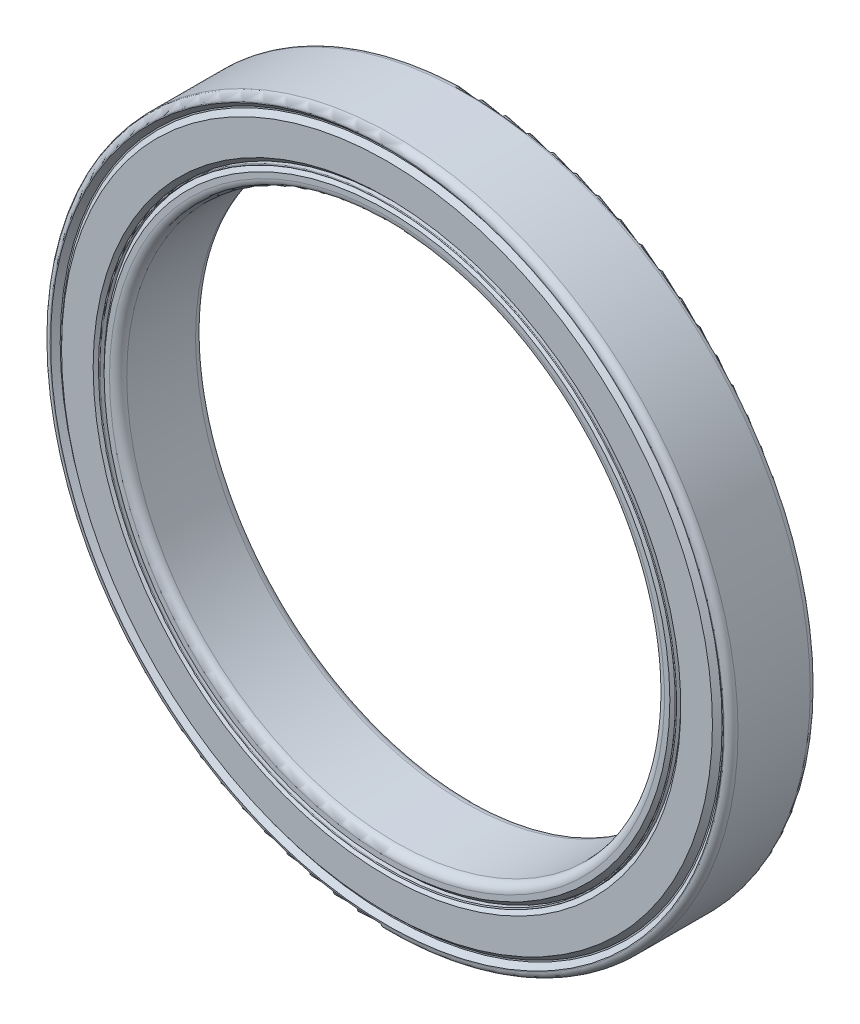
from build123d import *

# Parameters (mm, degrees)
SKETCH3_W         = 4
SKETCH3_H         = 0.583333333
SKETCH3_H_2       = 0.875
SKETCH4_R         = 1.225
CIRPATTERN1_COUNT = 23
FILLET1_R         = 0.32
FILLET2_R         = 0.4
CHAMFER1_SIZE     = 0.224
CHAMFER2_SIZE     = 0.224


with BuildPart() as part:
    # Sketch3 → Revolve1 (revolve)
    with BuildSketch(Plane(origin=(0, 0, 0), x_dir=(0, 0, -1), z_dir=(1, 0, 0)), mode=Mode.PRIVATE) as revolve1_sk:
        with Locations((0, -15.708333334)):
            Rectangle(SKETCH3_W, SKETCH3_H)
        with Locations((0, -12.9375)):
            Rectangle(SKETCH3_W, SKETCH3_H_2)
    revolve(revolve1_sk.sketch.rotate(Axis((0, 0, -2), (0, 0, 1)), 270), axis=Axis((0, 0, -2), (0, 0, 1)))

    # Sketch4 → Cut-Revolve1 (revolve, cut)
    with BuildSketch(Plane(origin=(0, 0, 0), x_dir=(0, 0, -1), z_dir=(1, 0, 0)), mode=Mode.PRIVATE) as cut_revolve1_sk:
        with Locations((0, -14.395833333)):
            Circle(SKETCH4_R)
    revolve(cut_revolve1_sk.sketch.rotate(Axis((0, 0, -2), (0, 0, 1)), 270), axis=Axis((0, 0, -2), (0, 0, 1)), mode=Mode.SUBTRACT)

    # Fillet1
    fillet1_edges = [part.edges().sort_by_distance(p)[0] for p in [
        (16, 0, -2),
        (16, 0, 2),
    ]]
    fillet(fillet1_edges, radius=FILLET1_R)

    # Fillet2
    fillet2_edges = [part.edges().sort_by_distance(p)[0] for p in [
        (12.5, 0, -2),
        (12.5, 0, 2),
    ]]
    fillet(fillet2_edges, radius=FILLET2_R)

    # Chamfer1
    chamfer1_edges = [part.edges().sort_by_distance(p)[0] for p in [
        (15.416666667, 0, 2),
        (15.416666667, 0, -2),
    ]]
    chamfer(chamfer1_edges, length=CHAMFER1_SIZE)

    # Chamfer2
    chamfer2_edges = [part.edges().sort_by_distance(p)[0] for p in [
        (13.375, 0, 2),
        (13.375, 0, -2),
    ]]
    chamfer(chamfer2_edges, length=CHAMFER2_SIZE)


with BuildPart() as body_2:
    # Sketch5 → Revolve2 (revolve)
    with BuildSketch(Plane(origin=(0, 0, 0), x_dir=(0, 0, -1), z_dir=(1, 0, 0))):
        with BuildLine():
            Line((0, -13.170833333), (0, -15.620833333))
            ThreePointArc((0, -15.620833333), (1.225, -14.395833333), (0, -13.170833333))
        make_face()
    revolve(axis=Axis((0, -13.170833333, 0), (0, -1, 0)))


with BuildPart() as cirpattern1_1:
    # CirPattern1: pattern copy
    add(body_2.part.rotate(Axis((0, 0, 0), (0, 0, 1)), 1 * 360 / CIRPATTERN1_COUNT))


with BuildPart() as cirpattern1_2:
    # CirPattern1: pattern copy
    add(body_2.part.rotate(Axis((0, 0, 0), (0, 0, 1)), 2 * 360 / CIRPATTERN1_COUNT))


with BuildPart() as cirpattern1_3:
    # CirPattern1: pattern copy
    add(body_2.part.rotate(Axis((0, 0, 0), (0, 0, 1)), 3 * 360 / CIRPATTERN1_COUNT))


with BuildPart() as cirpattern1_4:
    # CirPattern1: pattern copy
    add(body_2.part.rotate(Axis((0, 0, 0), (0, 0, 1)), 4 * 360 / CIRPATTERN1_COUNT))


with BuildPart() as cirpattern1_5:
    # CirPattern1: pattern copy
    add(body_2.part.rotate(Axis((0, 0, 0), (0, 0, 1)), 5 * 360 / CIRPATTERN1_COUNT))


with BuildPart() as cirpattern1_6:
    # CirPattern1: pattern copy
    add(body_2.part.rotate(Axis((0, 0, 0), (0, 0, 1)), 6 * 360 / CIRPATTERN1_COUNT))


with BuildPart() as cirpattern1_7:
    # CirPattern1: pattern copy
    add(body_2.part.rotate(Axis((0, 0, 0), (0, 0, 1)), 7 * 360 / CIRPATTERN1_COUNT))


with BuildPart() as cirpattern1_8:
    # CirPattern1: pattern copy
    add(body_2.part.rotate(Axis((0, 0, 0), (0, 0, 1)), 8 * 360 / CIRPATTERN1_COUNT))


with BuildPart() as cirpattern1_9:
    # CirPattern1: pattern copy
    add(body_2.part.rotate(Axis((0, 0, 0), (0, 0, 1)), 9 * 360 / CIRPATTERN1_COUNT))


with BuildPart() as cirpattern1_10:
    # CirPattern1: pattern copy
    add(body_2.part.rotate(Axis((0, 0, 0), (0, 0, 1)), 10 * 360 / CIRPATTERN1_COUNT))


with BuildPart() as cirpattern1_11:
    # CirPattern1: pattern copy
    add(body_2.part.rotate(Axis((0, 0, 0), (0, 0, 1)), 11 * 360 / CIRPATTERN1_COUNT))


with BuildPart() as cirpattern1_12:
    # CirPattern1: pattern copy
    add(body_2.part.rotate(Axis((0, 0, 0), (0, 0, 1)), 12 * 360 / CIRPATTERN1_COUNT))


with BuildPart() as cirpattern1_13:
    # CirPattern1: pattern copy
    add(body_2.part.rotate(Axis((0, 0, 0), (0, 0, 1)), 13 * 360 / CIRPATTERN1_COUNT))


with BuildPart() as cirpattern1_14:
    # CirPattern1: pattern copy
    add(body_2.part.rotate(Axis((0, 0, 0), (0, 0, 1)), 14 * 360 / CIRPATTERN1_COUNT))


with BuildPart() as cirpattern1_15:
    # CirPattern1: pattern copy
    add(body_2.part.rotate(Axis((0, 0, 0), (0, 0, 1)), 15 * 360 / CIRPATTERN1_COUNT))


with BuildPart() as cirpattern1_16:
    # CirPattern1: pattern copy
    add(body_2.part.rotate(Axis((0, 0, 0), (0, 0, 1)), 16 * 360 / CIRPATTERN1_COUNT))


with BuildPart() as cirpattern1_17:
    # CirPattern1: pattern copy
    add(body_2.part.rotate(Axis((0, 0, 0), (0, 0, 1)), 17 * 360 / CIRPATTERN1_COUNT))


with BuildPart() as cirpattern1_18:
    # CirPattern1: pattern copy
    add(body_2.part.rotate(Axis((0, 0, 0), (0, 0, 1)), 18 * 360 / CIRPATTERN1_COUNT))


with BuildPart() as cirpattern1_19:
    # CirPattern1: pattern copy
    add(body_2.part.rotate(Axis((0, 0, 0), (0, 0, 1)), 19 * 360 / CIRPATTERN1_COUNT))


with BuildPart() as cirpattern1_20:
    # CirPattern1: pattern copy
    add(body_2.part.rotate(Axis((0, 0, 0), (0, 0, 1)), 20 * 360 / CIRPATTERN1_COUNT))


with BuildPart() as cirpattern1_21:
    # CirPattern1: pattern copy
    add(body_2.part.rotate(Axis((0, 0, 0), (0, 0, 1)), 21 * 360 / CIRPATTERN1_COUNT))


with BuildPart() as cirpattern1_22:
    # CirPattern1: pattern copy
    add(body_2.part.rotate(Axis((0, 0, 0), (0, 0, 1)), 22 * 360 / CIRPATTERN1_COUNT))


with BuildPart() as body_25:
    # Sketch6 → Revolve3 (revolve)
    with BuildSketch(Plane(origin=(0, 0, 0), x_dir=(0, 0, -1), z_dir=(1, 0, 0)), mode=Mode.PRIVATE) as revolve3_sk:
        Polygon((-2, -13.66025), (-2, -15.131416667), (-1.776, -15.355416667), (-1.776, -15.416666667), (-1.225, -15.416666667), (-1.225, -13.375), (-1.776, -13.375), (-1.776, -13.43625), align=None)
        Polygon((1.776, -15.416666667), (1.225, -15.416666667), (1.225, -13.375), (1.776, -13.375), (1.776, -13.43625), (2, -13.66025), (2, -15.131416667), (1.776, -15.355416667), align=None)
    revolve(revolve3_sk.sketch.rotate(Axis((0, 0, -2), (0, 0, 1)), 270), axis=Axis((0, 0, -2), (0, 0, 1)))


with BuildPart() as body_26:
    # Sketch7 → Revolve4 (revolve)
    with BuildSketch(Plane(origin=(0, 0, 0), x_dir=(0, 0, -1), z_dir=(1, 0, 0)), mode=Mode.PRIVATE) as revolve4_sk:
        with BuildLine():
            Line((-1.776, -13.43625), (-1.776, -13.375))
            Line((-1.776, -13.375), (-1.969375, -13.375))
            ThreePointArc((-1.969375, -13.375), (-2, -13.405625), (-1.969375, -13.43625))
            Line((-1.969375, -13.43625), (-1.776, -13.43625))
        make_face()
        with BuildLine():
            Line((1.776, -13.375), (1.969375, -13.375))
            ThreePointArc((1.969375, -13.375), (2, -13.405625), (1.969375, -13.43625))
            Line((1.969375, -13.43625), (1.776, -13.43625))
            Line((1.776, -13.43625), (1.776, -13.375))
        make_face()
    revolve(revolve4_sk.sketch.rotate(Axis((0, 0, -2), (0, 0, 1)), 270), axis=Axis((0, 0, -2), (0, 0, 1)))


solid = Compound([part.part, body_2.part, cirpattern1_1.part, cirpattern1_2.part, cirpattern1_3.part, cirpattern1_4.part, cirpattern1_5.part, cirpattern1_6.part, cirpattern1_7.part, cirpattern1_8.part, cirpattern1_9.part, cirpattern1_10.part, cirpattern1_11.part, cirpattern1_12.part, cirpattern1_13.part, cirpattern1_14.part, cirpattern1_15.part, cirpattern1_16.part, cirpattern1_17.part, cirpattern1_18.part, cirpattern1_19.part, cirpattern1_20.part, cirpattern1_21.part, cirpattern1_22.part, body_25.part, body_26.part])
